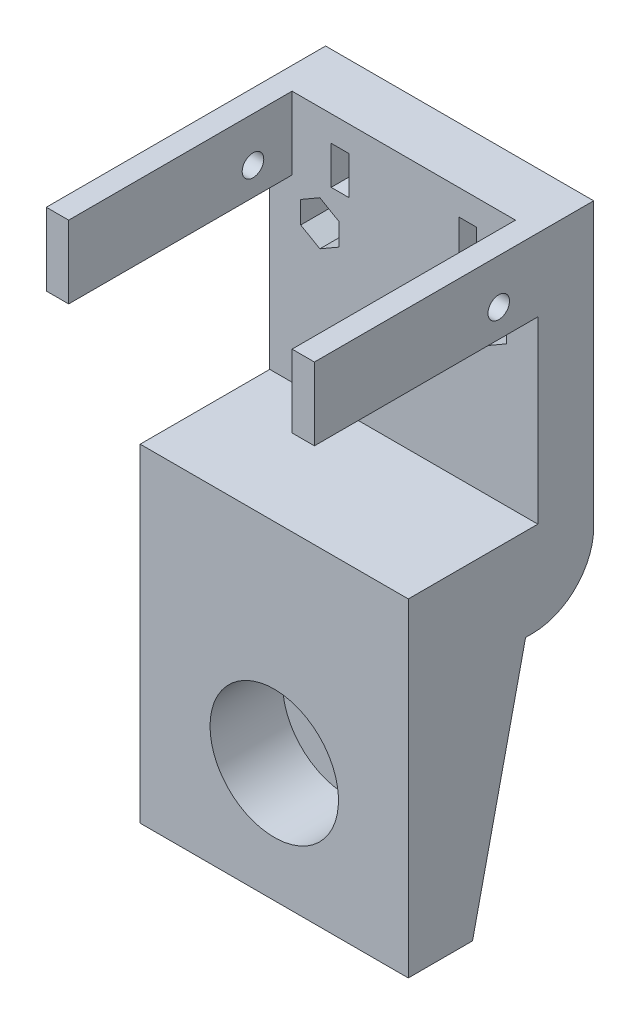
from build123d import *

# Parameters (mm, degrees)
SKETCH1_W           = 48
SKETCH1_H           = 53
SKETCH1_R           = 1.9304
BOSS_EXTRUDE1_DEPTH = 10
SKETCH2_W           = 48
SKETCH2_H           = 5.616325
BOSS_EXTRUDE2_DEPTH = 33.1917878
SKETCH4_W           = 4
SKETCH4_H           = 10
BOSS_EXTRUDE4_DEPTH = 40
SKETCH5_W           = 48
SKETCH5_H           = 10.8609375
BOSS_EXTRUDE5_DEPTH = 23.1917878
SKETCH6_W           = 48
SKETCH6_H           = 5
BOSS_EXTRUDE6_DEPTH = 42.3
CUT_EXTRUDE1_REACH  = 78.862
SKETCH8_R           = 11.5
SKETCH9_R           = 1.9304
CUT_EXTRUDE2_DEPTH  = 88.252507127
CUT_EXTRUDE3_REACH  = 89.253
SKETCH10_W          = 3.15468
SKETCH10_H          = 6.8326
BOSS_EXTRUDE7_START = 8
SKETCH11_W          = 48
SKETCH11_H          = 42.3
SKETCH11_R          = 11.5
BOSS_EXTRUDE7_DEPTH = 8
SKETCH12_W          = 48
SKETCH12_H          = 42.3
BOSS_EXTRUDE8_DEPTH = 8
FILLET1_R           = 11
BOSS_EXTRUDE9_DEPTH = 3
CUT_EXTRUDE4_DEPTH  = 6
CUT_EXTRUDE5_DEPTH  = 90.10667764


with BuildPart() as part:
    # Sketch1 → Boss-Extrude1 (new body)
    with BuildSketch(Plane.XY):
        with Locations((24, 26.5)):
            Rectangle(SKETCH1_W, SKETCH1_H)
        with Locations((8.975, 38)):
            Circle(SKETCH1_R, mode=Mode.SUBTRACT)
        with Locations((38.975, 38)):
            Circle(SKETCH1_R, mode=Mode.SUBTRACT)
    extrude(amount=BOSS_EXTRUDE1_DEPTH)

    # Sketch2 → Boss-Extrude2 (add)
    with BuildSketch(Plane(origin=(0, 0, 0), x_dir=(-1, 0, 0), z_dir=(0, 0, -1))):
        with Locations((-24, -2.8081625)):
            Rectangle(SKETCH2_W, SKETCH2_H)
    extrude(amount=-BOSS_EXTRUDE2_DEPTH)

    # Sketch4 → Boss-Extrude4 (add)
    with BuildSketch(Plane.XY.offset(10)):
        with Locations((2, 48)):
            Rectangle(SKETCH4_W, SKETCH4_H)
        with Locations((46, 48)):
            Rectangle(SKETCH4_W, SKETCH4_H)
    extrude(amount=BOSS_EXTRUDE4_DEPTH)

    # Sketch5 → Boss-Extrude5 (add)
    with BuildSketch(Plane.XY.offset(10)):
        with Locations((24, 5.43046875)):
            Rectangle(SKETCH5_W, SKETCH5_H)
    extrude(amount=BOSS_EXTRUDE5_DEPTH)

    # Sketch6 → Boss-Extrude6 (add)
    with BuildSketch(Plane.XZ.offset(5.616325)):
        with Locations((24, 30.6917878)):
            Rectangle(SKETCH6_W, SKETCH6_H)
    extrude(amount=BOSS_EXTRUDE6_DEPTH)

    # Sketch8 → Cut-Extrude1 (cut, up to next)
    with BuildSketch(Plane(origin=(0, 0, 28.1917878), x_dir=(-1, 0, 0), z_dir=(0, 0, -1)), mode=Mode.PRIVATE) as cut_extrude1_sk1:
        with Locations((-24, -26.616325)):
            Circle(SKETCH8_R)
    cut_extrude1_tool1 = extrude(cut_extrude1_sk1.sketch, amount=-CUT_EXTRUDE1_REACH, mode=Mode.PRIVATE) & part.part
    add(cut_extrude1_tool1.solids().sort_by_distance((24, -26.616325, 28.191788))[0], mode=Mode.SUBTRACT)

    # Sketch9 → Cut-Extrude2 (cut, through all)
    with BuildSketch(Plane(origin=(48, 0, 0), x_dir=(0, 0, -1), z_dir=(1, 0, 0))):
        with Locations((-17, 48)):
            Circle(SKETCH9_R)
    extrude(amount=-CUT_EXTRUDE2_DEPTH, mode=Mode.SUBTRACT)

    # Sketch10 → Cut-Extrude3 (cut, up to next)
    with BuildSketch(Plane(origin=(0, 0, 0), x_dir=(-1, 0, 0), z_dir=(0, 0, -1)), mode=Mode.PRIVATE) as cut_extrude3_sk1:
        with Locations((-35.42266, 48)):
            Rectangle(SKETCH10_W, SKETCH10_H)
    cut_extrude3_tool1 = extrude(cut_extrude3_sk1.sketch, amount=-CUT_EXTRUDE3_REACH, mode=Mode.PRIVATE) & part.part
    # Sketch10 → Cut-Extrude3 (cut, up to next)
    with BuildSketch(Plane(origin=(0, 0, 0), x_dir=(-1, 0, 0), z_dir=(0, 0, -1)), mode=Mode.PRIVATE) as cut_extrude3_sk2:
        with Locations((-12.57734, 48)):
            Rectangle(SKETCH10_W, SKETCH10_H)
    cut_extrude3_tool2 = extrude(cut_extrude3_sk2.sketch, amount=-CUT_EXTRUDE3_REACH, mode=Mode.PRIVATE) & part.part
    add(cut_extrude3_tool1.solids().sort_by_distance((35.42266, 48, 0))[0], mode=Mode.SUBTRACT)
    add(cut_extrude3_tool2.solids().sort_by_distance((12.57734, 48, 0))[0], mode=Mode.SUBTRACT)

    # Sketch11 → Boss-Extrude7 (add)
    with BuildSketch(Plane(origin=(0, 0, 28.1917878), x_dir=(-1, 0, 0), z_dir=(0, 0, -1)).offset(BOSS_EXTRUDE7_START)):
        with Locations((-24, -26.766325)):
            Rectangle(SKETCH11_W, SKETCH11_H)
        with Locations((-24, -26.616325)):
            Circle(SKETCH11_R, mode=Mode.SUBTRACT)
    extrude(amount=-BOSS_EXTRUDE7_DEPTH)

    # Sketch12 → Boss-Extrude8 (add)
    with BuildSketch(Plane(origin=(0, 0, 20.1917878), x_dir=(-1, 0, 0), z_dir=(0, 0, -1))):
        with Locations((-24, -26.766325)):
            Rectangle(SKETCH12_W, SKETCH12_H)
    extrude(amount=BOSS_EXTRUDE8_DEPTH)

    # Fillet1
    fillet1_edges = [part.edges().sort_by_distance(p)[0] for p in [
        (24, -5.616325, 0),
    ]]
    fillet(fillet1_edges, radius=FILLET1_R)

    # Sketch13 → Boss-Extrude9 (add)
    with BuildSketch(Plane(origin=(0, 53, 0), x_dir=(1, 0, 0), z_dir=(0, 1, 0))):
        Polygon((0, 0), (0, -50), (4, -50), (4, -10), (44, -10), (44, -50), (48, -50), (48, 0), align=None)
    extrude(amount=BOSS_EXTRUDE9_DEPTH)

    # Sketch14 → Cut-Extrude4 (cut)
    with BuildSketch(Plane.XY.offset(10)):
        Polygon((8.975, 41.9594682), (5.545999953, 39.9797341), (5.545999953, 36.0202659), (8.975, 34.0405318), (12.404000047, 36.0202659), (12.404000047, 39.9797341), align=None)
        Polygon((38.975, 41.9594682), (35.545999953, 39.9797341), (35.545999953, 36.0202659), (38.975, 34.0405318), (42.404000047, 36.0202659), (42.404000047, 39.9797341), align=None)
    extrude(amount=-CUT_EXTRUDE4_DEPTH, mode=Mode.SUBTRACT)

    # Sketch15 → Cut-Extrude5 (cut, through all)
    with BuildSketch(Plane(origin=(48, 0, 0), x_dir=(0, 0, -1), z_dir=(1, 0, 0))):
        Polygon((-12.1917878, -5.616325), (-21.691694695, -47.916325), (-12.1917878, -47.916325), align=None)
    extrude(amount=-CUT_EXTRUDE5_DEPTH, mode=Mode.SUBTRACT)


solid = part.part
